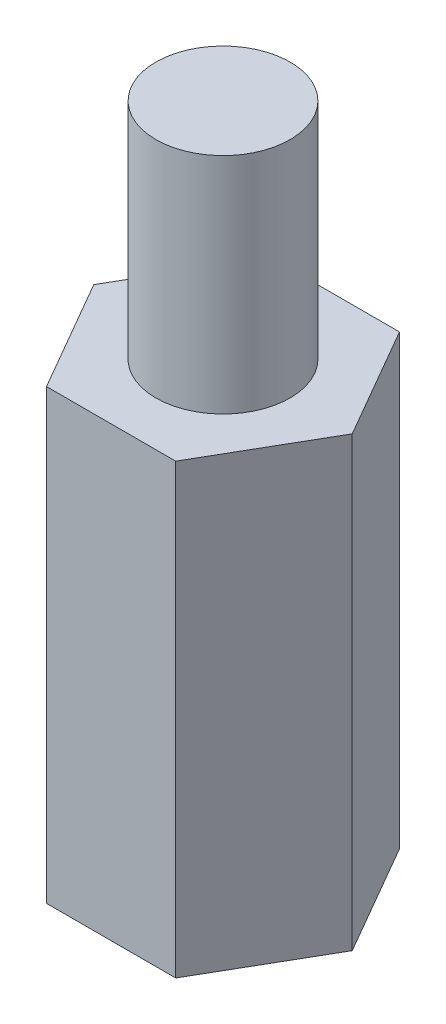
from build123d import *

# Parameters (mm, degrees)
EXTRUDE_1_DEPTH     = 10
SKETCH_2_R          = 1.5
EXTRUDE_2_DEPTH     = 5
SKETCH_3_R          = 1.5
CUT_EXTRUDE_1_DEPTH = 6


with BuildPart() as part:
    # 스케치1 → 보스-돌출1 (new body)
    with BuildSketch(Plane(origin=(0, 0, 0), x_dir=(1, 0, 0), z_dir=(0, 1, 0))):
        Polygon((-1.443375673, -2.5), (1.443375673, -2.5), (2.886751346, 0), (1.443375673, 2.5), (-1.443375673, 2.5), (-2.886751346, 0), align=None)
    extrude(amount=EXTRUDE_1_DEPTH)

    # 스케치2 → 보스-돌출2 (add)
    with BuildSketch(Plane(origin=(0, 10, 0), x_dir=(1, 0, 0), z_dir=(0, 1, 0))):
        with Locations(Location((0, 0, 0), (0, 0, 270))):
            Circle(SKETCH_2_R)
    extrude(amount=EXTRUDE_2_DEPTH)

    # 스케치3 → 컷-돌출1 (cut)
    with BuildSketch(Plane.XZ):
        with Locations(Location((0, 0, 0), (0, 0, 90))):
            Circle(SKETCH_3_R)
    extrude(amount=-CUT_EXTRUDE_1_DEPTH, mode=Mode.SUBTRACT)


solid = part.part
